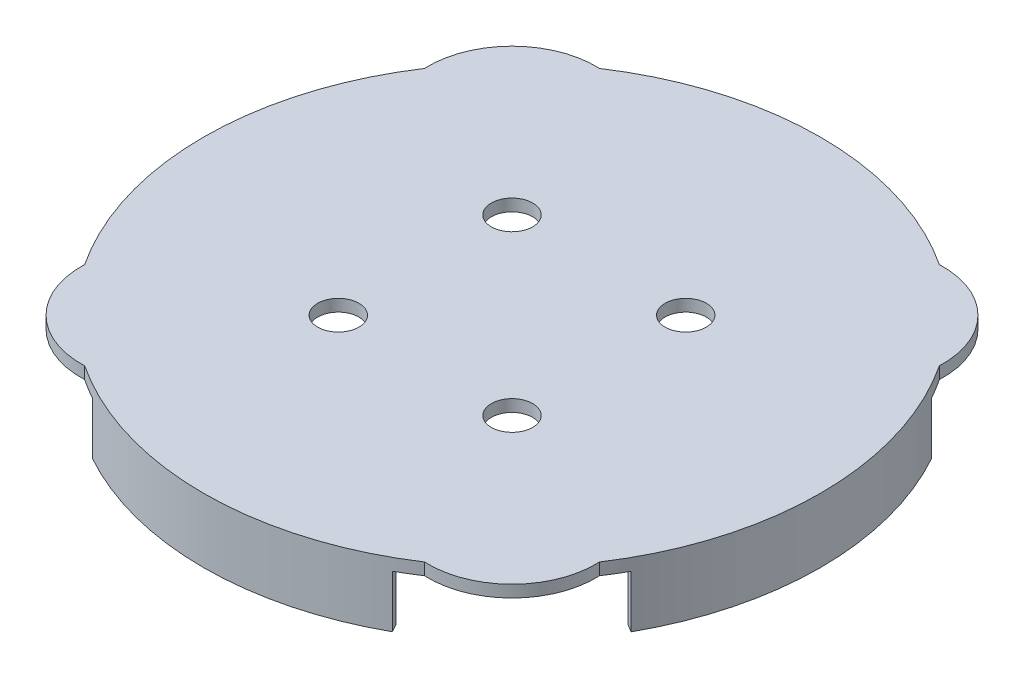
from build123d import *

# Parameters (mm, degrees)
SKETCH1_R           = 3.45
BOSS_EXTRUDE1_DEPTH = 2
BOSS_EXTRUDE2_START = 8.75
BOSS_EXTRUDE2_DEPTH = 8.75
CIRPATTERN1_COUNT   = 4


with BuildPart() as part:
    # Sketch1 → Boss-Extrude1 (new body)
    with BuildSketch(Plane(origin=(0, 0, 0), x_dir=(1, 0, 0), z_dir=(0, 1, 0))):
        with BuildLine():
            ThreePointArc((28.363609444, -42.985528487), (38.899494937, -38.899494937), (42.985528487, -28.363609444))
            ThreePointArc((42.985528487, -28.363609444), (51.5, 0), (42.985528487, 28.363609444))
            ThreePointArc((42.985528487, 28.363609444), (38.899494937, 38.899494937), (28.363609444, 42.985528487))
            ThreePointArc((28.363609444, 42.985528487), (0, 51.5), (-28.363609444, 42.985528487))
            ThreePointArc((-28.363609444, 42.985528487), (-38.899494937, 38.899494937), (-42.985528487, 28.363609444))
            ThreePointArc((-42.985528487, 28.363609444), (-51.5, 0), (-42.985528487, -28.363609444))
            ThreePointArc((-42.985528487, -28.363609444), (-38.899494937, -38.899494937), (-28.363609444, -42.985528487))
            ThreePointArc((-28.363609444, -42.985528487), (0, -51.5), (28.363609444, -42.985528487))
        make_face()
        with Locations(Location((14.5, 14.5, 0), (0, 0, 270))):
            Circle(SKETCH1_R, mode=Mode.SUBTRACT)
        with Locations(Location((-14.5, 14.5, 0), (0, 0, 270))):
            Circle(SKETCH1_R, mode=Mode.SUBTRACT)
        with Locations(Location((-14.5, -14.5, 0), (0, 0, 270))):
            Circle(SKETCH1_R, mode=Mode.SUBTRACT)
        with Locations(Location((14.5, -14.5, 0), (0, 0, 270))):
            Circle(SKETCH1_R, mode=Mode.SUBTRACT)
    extrude(amount=BOSS_EXTRUDE1_DEPTH)

    # Sketch2 → Boss-Extrude2 (add)
    with BuildSketch(Plane.XZ.offset(BOSS_EXTRUDE2_START)):
        with BuildLine():
            Line((43.690302721, -24.313729622), (45.001011803, -25.043141511))
            ThreePointArc((45.001011803, -25.043141511), (51.499991825, 0.029017326), (44.972762458, 25.093836632))
            Line((44.972762458, 25.093836632), (43.690302721, 24.313729622))
            ThreePointArc((43.690302721, 24.313729622), (50, 0), (43.690302721, -24.313729622))
        make_face()
    boss_extrude2 = extrude(amount=-BOSS_EXTRUDE2_DEPTH)

    # CirPattern1: Boss-Extrude2 ×4 about axis
    cirpattern1_axis = Axis((0, 0, 0), (0, 1, 0))
    for i in range(1, CIRPATTERN1_COUNT):
        add(boss_extrude2.rotate(cirpattern1_axis, i * 360 / CIRPATTERN1_COUNT))


solid = part.part
